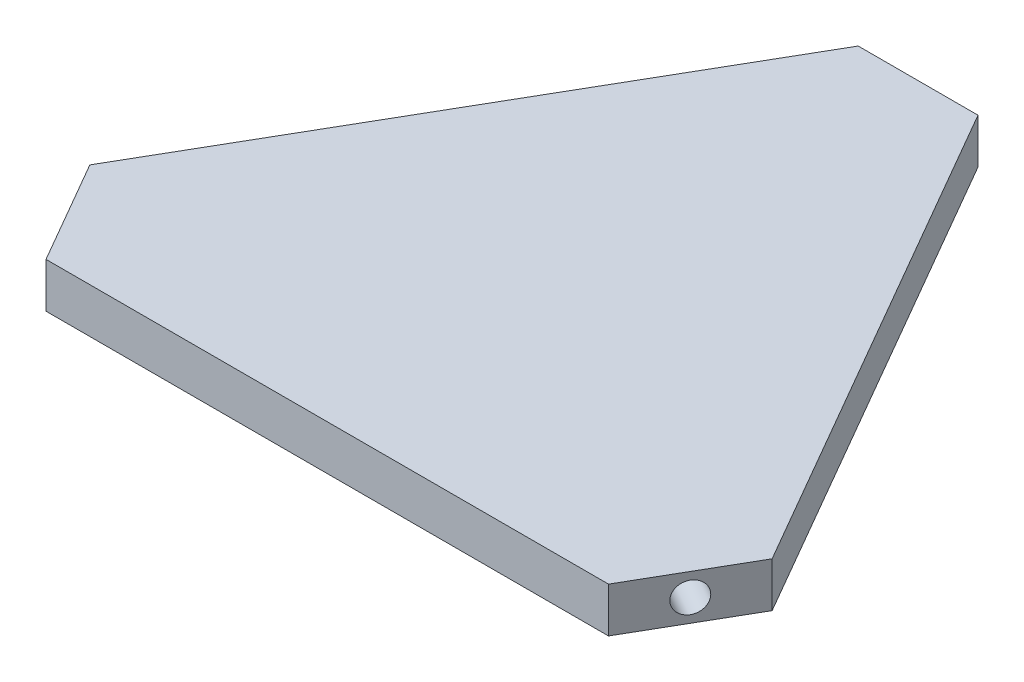
from build123d import *

# Parameters (mm, degrees)
BOSS_EXTRUDE1_DEPTH = 4.7625
CIRPATTERN1_COUNT   = 3


with BuildPart() as part:
    # Sketch1 → Boss-Extrude1 (new, symmetric)
    with BuildSketch(Plane(origin=(0, 0, 0), x_dir=(1, 0, 0), z_dir=(0, 1, 0))):
        Polygon((12.7, 76.2), (-12.7, 76.2), (-72.341135768, -27.101477372), (-59.641135768, -49.098522628), (59.641135768, -49.098522628), (72.341135768, -27.101477372), align=None)
    extrude(amount=BOSS_EXTRUDE1_DEPTH, both=True)

    # Sketch5 → 1/4 (0.25) Diameter Hole1 (revolve, cut)
    with BuildSketch(Plane(origin=(65.991135768, 0, 38.1), x_dir=(0.500000000000001, 0, -0.8660254037844382), z_dir=(0, 1, 0))):
        Polygon((0, 0), (0, 14.607732465), (3.175, 12.7), (3.175, 0), align=None)
    f_1_4_0_25_diameter_hole1 = revolve(axis=Axis((71.490397082, 0, 41.275), (-0.866025403784438, 0, -0.500000000000001)), mode=Mode.SUBTRACT)

    # CirPattern1: 1/4 (0.25) Diameter Hole1 ×3 about axis
    cirpattern1_axis = Axis((0, 4.7625, 0), (0, 1, 0))
    for i in range(1, CIRPATTERN1_COUNT):
        add(f_1_4_0_25_diameter_hole1.rotate(cirpattern1_axis, i * 360 / CIRPATTERN1_COUNT), mode=Mode.SUBTRACT)


solid = part.part
